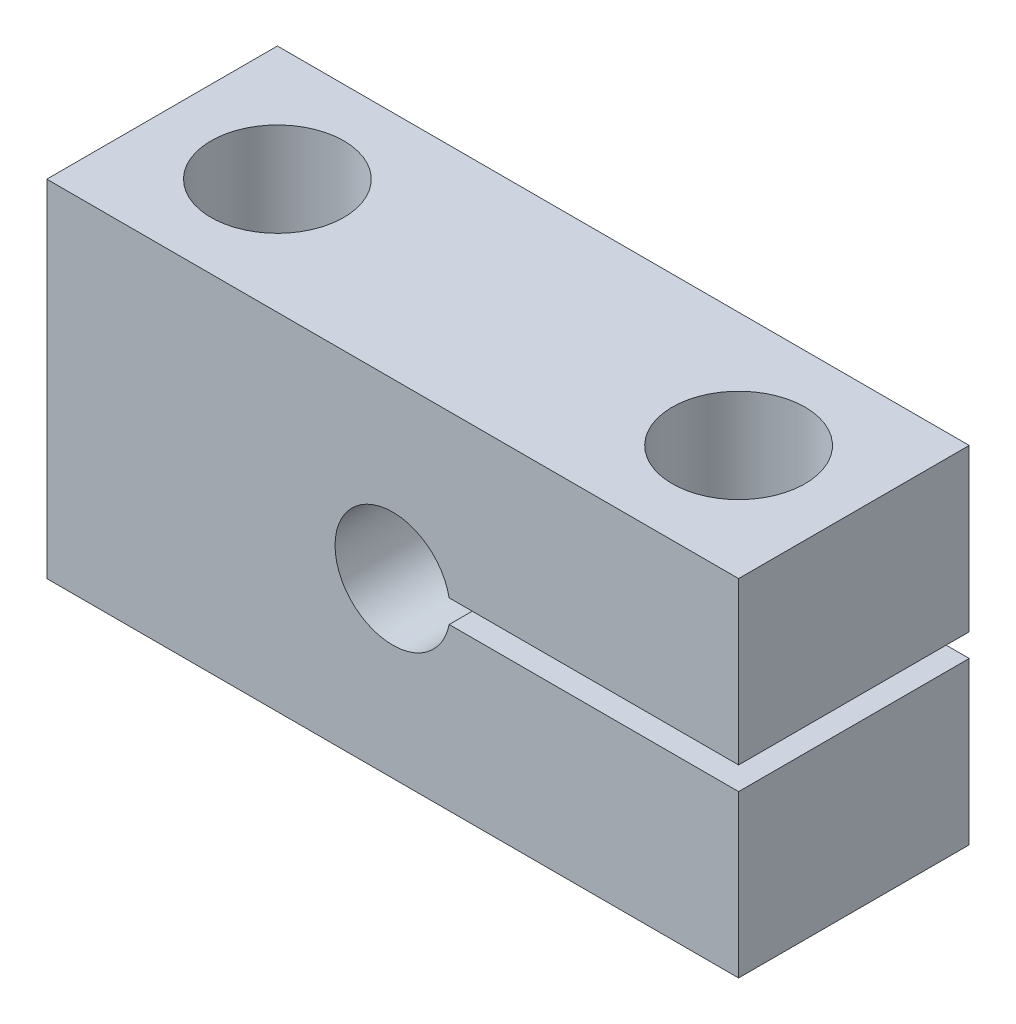
from build123d import *

# Parameters (mm, degrees)
BOSS_EXTRUDE1_DEPTH = 6.35
SKETCH2_R           = 1.8288
CUT_EXTRUDE1_DEPTH  = 15.892070037


with BuildPart() as part:
    # Sketch1 → Boss-Extrude1 (new body)
    with BuildSketch(Plane.XY):
        with BuildLine():
            Line((-9.525, -4.7625), (9.525, -4.7625))
            Line((9.525, -4.7625), (9.525, -0.3175))
            Line((9.525, -0.3175), (1.555425987, -0.3175))
            ThreePointArc((1.555425987, -0.3175), (-1.5875, 0), (1.555425987, 0.3175))
            Line((1.555425987, 0.3175), (9.525, 0.3175))
            Line((9.525, 0.3175), (9.525, 4.7625))
            Line((9.525, 4.7625), (-9.525, 4.7625))
            Line((-9.525, 4.7625), (-9.525, -4.7625))
        make_face()
    extrude(amount=BOSS_EXTRUDE1_DEPTH)

    # Sketch2 → Cut-Extrude1 (cut, through all)
    with BuildSketch(Plane.XZ.offset(4.7625)):
        with Locations(Location((-6.35, 3.175, 0), (0, 0, 270))):
            Circle(SKETCH2_R)
        with Locations(Location((6.35, 3.175, 0), (0, 0, 270))):
            Circle(SKETCH2_R)
    extrude(amount=-CUT_EXTRUDE1_DEPTH, mode=Mode.SUBTRACT)


solid = part.part
